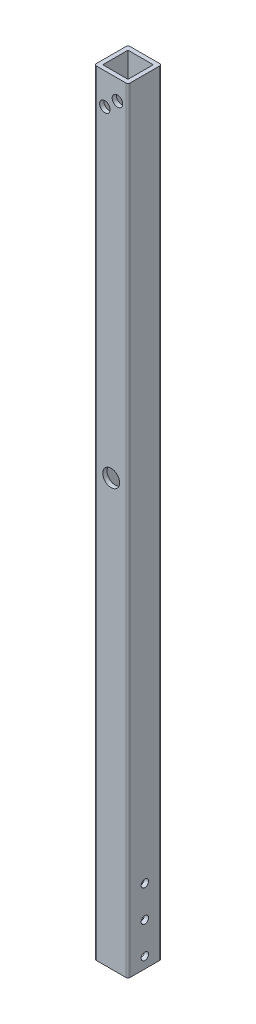
from build123d import *

# Parameters (mm, degrees)
SKETCH1_W           = 16
SKETCH1_H           = 16
SKETCH1_W_2         = 12
SKETCH1_H_2         = 12
BOSS_EXTRUDE1_DEPTH = 368
FILLET1_R           = 1
SKETCH2_R           = 1.75
CUT_EXTRUDE1_DEPTH  = 16
SKETCH3_R           = 4
CUT_EXTRUDE2_DEPTH  = 16
SKETCH4_R           = 2.5
CUT_EXTRUDE3_DEPTH  = 20


with BuildPart() as part:
    # Sketch1 → Boss-Extrude1 (new body)
    with BuildSketch(Plane(origin=(0, 0, 0), x_dir=(1, 0, 0), z_dir=(0, 1, 0))):
        with Locations((0.761904762, -3.156462585)):
            Rectangle(SKETCH1_W, SKETCH1_H)
        with Locations((0.761904762, -3.156462585)):
            Rectangle(SKETCH1_W_2, SKETCH1_H_2, mode=Mode.SUBTRACT)
    extrude(amount=BOSS_EXTRUDE1_DEPTH)

    # Fillet1
    fillet1_edges = [part.edges().sort_by_distance(p)[0] for p in [
        (-7.238095238, 184, -4.843537415),
        (8.761904762, 184, -4.843537415),
        (8.761904762, 184, 11.156462585),
        (-7.238095238, 184, 11.156462585),
    ]]
    fillet(fillet1_edges, radius=FILLET1_R)

    # Sketch2 → Cut-Extrude1 (cut)
    with BuildSketch(Plane.ZY.offset(7.238095238)):
        with Locations((3.156462585, 5.25)):
            Circle(SKETCH2_R)
        with Locations((3.156462585, 20.25)):
            Circle(SKETCH2_R)
        with Locations((3.156462585, 35.25)):
            Circle(SKETCH2_R)
    extrude(amount=-CUT_EXTRUDE1_DEPTH, mode=Mode.SUBTRACT)

    # Sketch3 → Cut-Extrude2 (cut)
    with BuildSketch(Plane(origin=(0, 0, -4.843537415), x_dir=(-1, 0, 0), z_dir=(0, 0, -1))):
        with Locations((-0.761904762, 202)):
            Circle(SKETCH3_R)
    extrude(amount=-CUT_EXTRUDE2_DEPTH, mode=Mode.SUBTRACT)

    # Sketch4 → Cut-Extrude3 (cut)
    with BuildSketch(Plane.XY.offset(11.156462585)):
        with Locations((-2.232226364, 353.25267067)):
            Circle(SKETCH4_R)
        with Locations((3.753864965, 358.559902585)):
            Circle(SKETCH4_R)
    extrude(amount=-CUT_EXTRUDE3_DEPTH, mode=Mode.SUBTRACT)


solid = part.part
